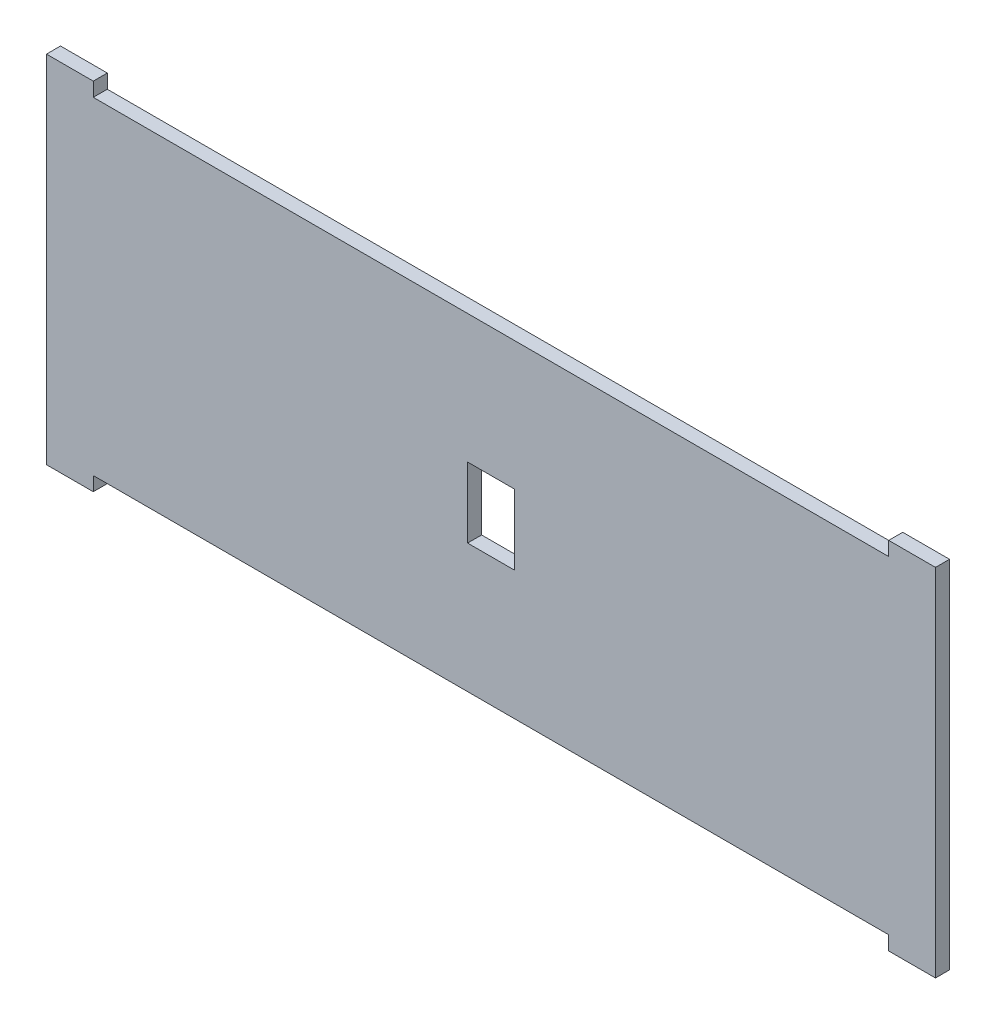
from build123d import *

# Parameters (mm, degrees)
ESBO_O1_W                = 10
ESBO_O1_H                = 3
ESBO_O1_W_2              = 190
ESBO_O1_H_2              = 70
RESSALTO_EXTRUS_O1_DEPTH = 3
ESBO_O2_W                = 10
ESBO_O2_H                = 15
CORTE_EXTRUS_O1_DEPTH    = 10


with BuildPart() as part:
    # Esboço1 → Ressalto-extrusão1 (new body)
    with BuildSketch(Plane.XY):
        with Locations((-90, -36.5)):
            Rectangle(ESBO_O1_W, ESBO_O1_H)
        with Locations((-90, 36.5)):
            Rectangle(ESBO_O1_W, ESBO_O1_H)
        Rectangle(ESBO_O1_W_2, ESBO_O1_H_2)
        with Locations((90, 36.5)):
            Rectangle(ESBO_O1_W, ESBO_O1_H)
        with Locations((90, -36.5)):
            Rectangle(ESBO_O1_W, ESBO_O1_H)
    extrude(amount=RESSALTO_EXTRUS_O1_DEPTH)

    # Esboço2 → Corte-extrusão1 (cut)
    with BuildSketch(Plane.XY.offset(3)):
        Rectangle(ESBO_O2_W, ESBO_O2_H)
    extrude(amount=-CORTE_EXTRUS_O1_DEPTH, mode=Mode.SUBTRACT)


solid = part.part
